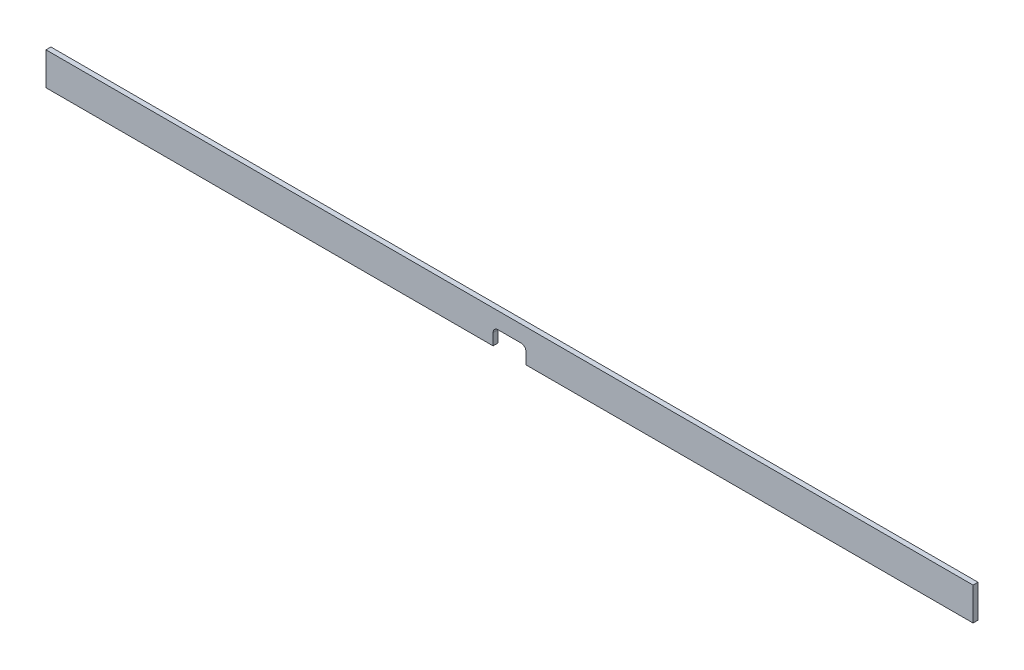
from build123d import *

# Parameters (mm, degrees)
EXTRUDE_1_DEPTH = 3


with BuildPart() as part:
    # 草圖1 → 填料-伸長1 (new body)
    with BuildSketch(Plane.XY):
        with BuildLine():
            Line((-282, -10), (-10, -10))
            Line((-10, -10), (-10, -3))
            ThreePointArc((-10, -3), (-9.121320344, -0.878679656), (-7, 0))
            Line((-7, 0), (7, 0))
            ThreePointArc((7, 0), (9.121320344, -0.878679656), (10, -3))
            Line((10, -3), (10, -10))
            Line((10, -10), (282, -10))
            Line((282, -10), (282, 10))
            Line((282, 10), (-282, 10))
            Line((-282, 10), (-282, -10))
        make_face()
    extrude(amount=EXTRUDE_1_DEPTH)


solid = part.part
